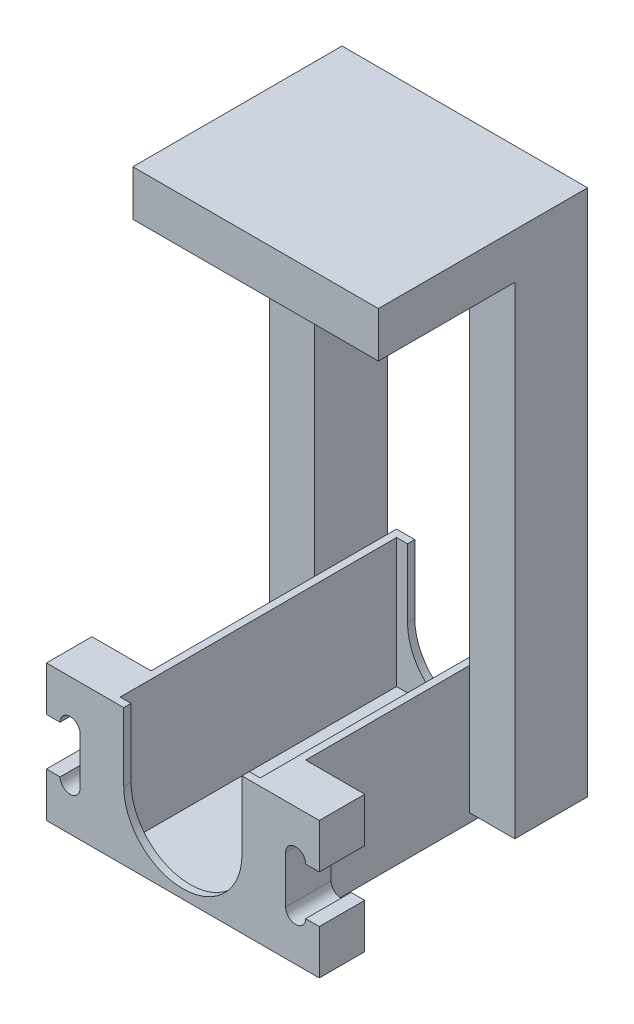
from build123d import *

# Parameters (mm, degrees)
CROQUIS1_W              = 17
CROQUIS1_H              = 15
SALIENTE_EXTRUIR1_DEPTH = 32
VACIADO1_T              = -0.8
CORTAR_EXTRUIR1_DEPTH   = 32
CROQUIS3_W              = 5
CROQUIS3_H              = 15
SALIENTE_EXTRUIR2_DEPTH = 6.5
CROQUIS4_W              = 5
CROQUIS4_H              = 15
SALIENTE_EXTRUIR3_DEPTH = 6.5
CORTAR_EXTRUIR2_DEPTH   = 6.5
CROQUIS6_W              = 1.5
CROQUIS6_H              = 5.2
CORTAR_EXTRUIR3_DEPTH   = 10
CROQUIS7_W              = 8
CROQUIS7_H              = 13
SALIENTE_EXTRUIR4_DEPTH = 5
CROQUIS8_W              = 8
CROQUIS8_H              = 13
SALIENTE_EXTRUIR5_DEPTH = 5
CROQUIS9_W              = 5
CROQUIS9_H              = 8
SALIENTE_EXTRUIR6_DEPTH = 45
CROQUIS10_W             = 5
CROQUIS10_H             = 5
SALIENTE_EXTRUIR7_DEPTH = 15
CROQUIS11_W             = 23
CROQUIS11_H             = 5
SALIENTE_EXTRUIR8_DEPTH = 11.5
CROQUIS12_W             = 23
CROQUIS12_H             = 5
SALIENTE_EXTRUIR9_DEPTH = 11.5


with BuildPart() as part:
    # Croquis1 → Saliente-Extruir1 (new body)
    with BuildSketch(Plane.XY):
        Rectangle(CROQUIS1_W, CROQUIS1_H)
    extrude(amount=SALIENTE_EXTRUIR1_DEPTH)

    # Vaciado1
    vaciado1_openings = [part.faces().sort_by_distance(p)[0] for p in [
        (0, 7.5, 16),
    ]]
    offset(amount=VACIADO1_T, openings=vaciado1_openings, kind=Kind.INTERSECTION)

    # Croquis2 → Cortar-Extruir1 (cut)
    with BuildSketch(Plane.XY.offset(32)):
        with BuildLine():
            Line((-6.5, 0), (-6.5, 7.5))
            Line((-6.5, 7.5), (6.5, 7.5))
            Line((6.5, 7.5), (6.5, 0))
            ThreePointArc((6.5, 0), (0, -6.5), (-6.5, 0))
        make_face()
    extrude(amount=-CORTAR_EXTRUIR1_DEPTH, mode=Mode.SUBTRACT)

    # Croquis3 → Saliente-Extruir2 (add)
    with BuildSketch(Plane(origin=(8.5, 0, 0), x_dir=(0, 0, -1), z_dir=(1, 0, 0))):
        with Locations((-29.5, 0)):
            Rectangle(CROQUIS3_W, CROQUIS3_H)
    extrude(amount=SALIENTE_EXTRUIR2_DEPTH)

    # Croquis4 → Saliente-Extruir3 (add)
    with BuildSketch(Plane.ZY.offset(8.5)):
        with Locations((29.5, 0)):
            Rectangle(CROQUIS4_W, CROQUIS4_H)
    extrude(amount=SALIENTE_EXTRUIR3_DEPTH)

    # Croquis5 → Cortar-Extruir2 (cut)
    with BuildSketch(Plane.XY.offset(32)):
        with BuildLine():
            Line((-13.5, 2.6), (-13.5, -2.6))
            ThreePointArc((-13.5, -2.6), (-12.4, -3.7), (-11.3, -2.6))
            Line((-11.3, -2.6), (-11.3, 2.6))
            ThreePointArc((-11.3, 2.6), (-12.4, 3.7), (-13.5, 2.6))
        make_face()
        with BuildLine():
            Line((11.3, 2.6), (11.3, -2.6))
            ThreePointArc((11.3, -2.6), (12.4, -3.7), (13.5, -2.6))
            Line((13.5, -2.6), (13.5, 2.6))
            ThreePointArc((13.5, 2.6), (12.4, 3.7), (11.3, 2.6))
        make_face()
    extrude(amount=-CORTAR_EXTRUIR2_DEPTH, mode=Mode.SUBTRACT)

    # Croquis6 → Cortar-Extruir3 (cut)
    with BuildSketch(Plane.XY.offset(32)):
        with Locations((-14.25, 0)):
            Rectangle(CROQUIS6_W, CROQUIS6_H)
        with Locations((14.25, 0)):
            Rectangle(CROQUIS6_W, CROQUIS6_H)
    extrude(amount=-CORTAR_EXTRUIR3_DEPTH, mode=Mode.SUBTRACT)

    # Croquis7 → Saliente-Extruir4 (add)
    with BuildSketch(Plane(origin=(8.5, 0, 0), x_dir=(0, 0, -1), z_dir=(1, 0, 0))):
        with Locations((-5, 0)):
            Rectangle(CROQUIS7_W, CROQUIS7_H)
    extrude(amount=SALIENTE_EXTRUIR4_DEPTH)

    # Croquis8 → Saliente-Extruir5 (add)
    with BuildSketch(Plane.ZY.offset(8.5)):
        with Locations((5, 0)):
            Rectangle(CROQUIS8_W, CROQUIS8_H)
    extrude(amount=SALIENTE_EXTRUIR5_DEPTH)

    # Croquis9 → Saliente-Extruir6 (add)
    with BuildSketch(Plane(origin=(0, 6.5, 0), x_dir=(1, 0, 0), z_dir=(0, 1, 0))):
        with Locations((-11, -5)):
            Rectangle(CROQUIS9_W, CROQUIS9_H)
        with Locations((11, -5)):
            Rectangle(CROQUIS9_W, CROQUIS9_H)
    extrude(amount=SALIENTE_EXTRUIR6_DEPTH)

    # Croquis10 → Saliente-Extruir7 (add)
    with BuildSketch(Plane.XY.offset(9)):
        with Locations((-11, 49)):
            Rectangle(CROQUIS10_W, CROQUIS10_H)
        with Locations((11, 49)):
            Rectangle(CROQUIS10_W, CROQUIS10_H)
    extrude(amount=SALIENTE_EXTRUIR7_DEPTH)

    # Croquis11 → Saliente-Extruir8 (add)
    with BuildSketch(Plane(origin=(-8.5, 0, 0), x_dir=(0, 0, -1), z_dir=(1, 0, 0))):
        with Locations((-12.5, 49)):
            Rectangle(CROQUIS11_W, CROQUIS11_H)
    extrude(amount=SALIENTE_EXTRUIR8_DEPTH)

    # Croquis12 → Saliente-Extruir9 (add)
    with BuildSketch(Plane.ZY.offset(-8.5)):
        with Locations((12.5, 49)):
            Rectangle(CROQUIS12_W, CROQUIS12_H)
    extrude(amount=SALIENTE_EXTRUIR9_DEPTH)


solid = part.part
